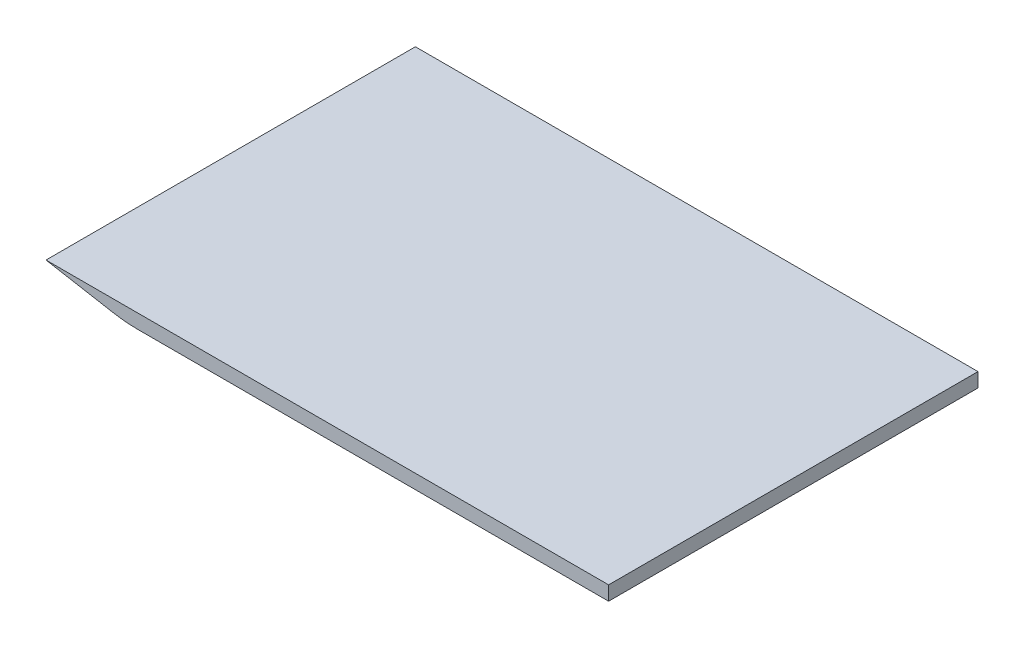
from build123d import *

# Parameters (mm, degrees)
BOSS_EXTRUDE1_DEPTH = 130
FILLET1_R           = 50


with BuildPart() as part:
    # Sketch1 → Boss-Extrude1 (new body)
    with BuildSketch(Plane.XY):
        Polygon((0, 0), (198, 0), (198, -5), (28, -5), align=None)
    extrude(amount=BOSS_EXTRUDE1_DEPTH)

    # Fillet1
    fillet1_edges = [part.edges().sort_by_distance(p)[0] for p in [
        (28, -5, 65),
    ]]
    fillet(fillet1_edges, radius=FILLET1_R)


solid = part.part
